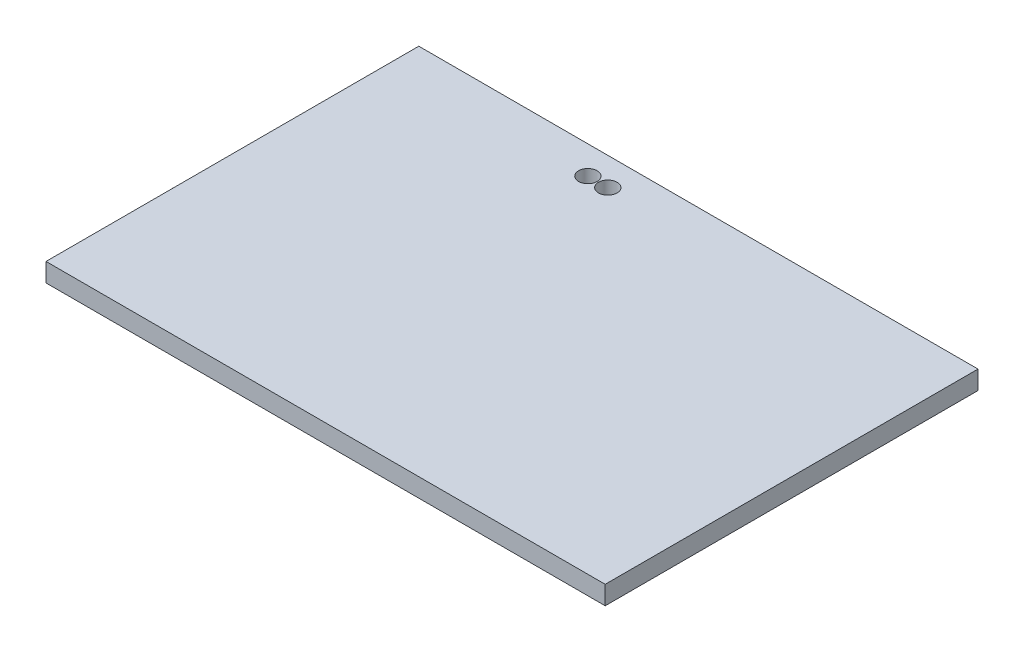
from build123d import *

# Parameters (mm, degrees)
CROQUIS1_W              = 300
CROQUIS1_H              = 200
SALIENTE_EXTRUIR1_DEPTH = 10
CROQUIS2_R              = 5
CORTAR_EXTRUIR2_DEPTH   = 10


with BuildPart() as part:
    # Croquis1 → Saliente-Extruir1 (new body)
    with BuildSketch(Plane(origin=(0, 0, 0), x_dir=(1, 0, 0), z_dir=(0, 1, 0))):
        Rectangle(CROQUIS1_W, CROQUIS1_H)
    extrude(amount=SALIENTE_EXTRUIR1_DEPTH)

    # Croquis2 → Cortar-Extruir2 (cut)
    with BuildSketch(Plane(origin=(0, 10, 0), x_dir=(1, 0, 0), z_dir=(0, 1, 0))):
        with Locations(Location((-44.281034273, 85, 0), (0, 0, 270))):
            Circle(CROQUIS2_R)
        with Locations(Location((-33.610743348, 85, 0), (0, 0, 270))):
            Circle(CROQUIS2_R)
    extrude(amount=-CORTAR_EXTRUIR2_DEPTH, mode=Mode.SUBTRACT)


solid = part.part
